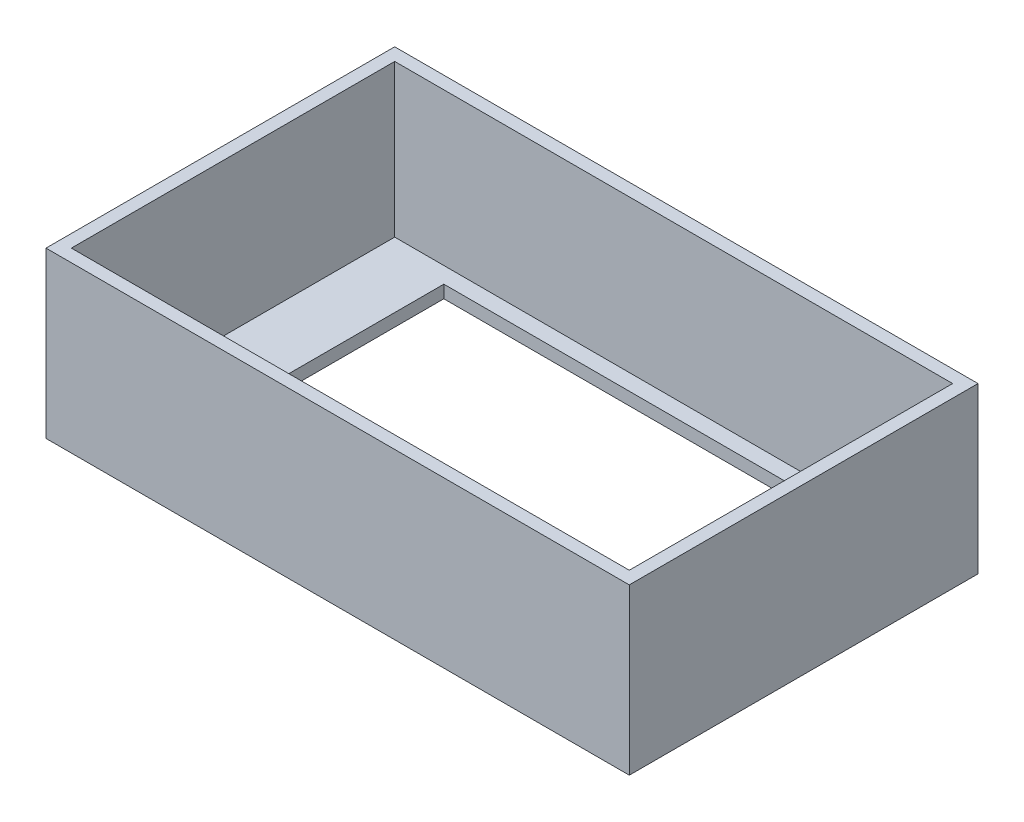
from build123d import *

# Parameters (mm, degrees)
SKETCH1_W           = 88
SKETCH1_H           = 51
BOSS_EXTRUDE1_DEPTH = 2
SKETCH2_W           = 60.2
SKETCH2_H           = 45.9
CUT_EXTRUDE1_DEPTH  = 2
SKETCH3_W           = 92
SKETCH3_H           = 55
SKETCH3_W_2         = 88
SKETCH3_H_2         = 51
BOSS_EXTRUDE2_DEPTH = 26


with BuildPart() as part:
    # Sketch1 → Boss-Extrude1 (new body)
    with BuildSketch(Plane(origin=(0, 0, 0), x_dir=(1, 0, 0), z_dir=(0, 1, 0))):
        Rectangle(SKETCH1_W, SKETCH1_H)
    extrude(amount=BOSS_EXTRUDE1_DEPTH)

    # Sketch2 → Cut-Extrude1 (cut)
    with BuildSketch(Plane(origin=(0, 0, 0), x_dir=(1, 0, 0), z_dir=(0, 1, 0))):
        with Locations((-3.6, 0)):
            Rectangle(SKETCH2_W, SKETCH2_H)
    extrude(amount=CUT_EXTRUDE1_DEPTH, mode=Mode.SUBTRACT)

    # Sketch3 → Boss-Extrude2 (add)
    with BuildSketch(Plane(origin=(0, 0, 0), x_dir=(1, 0, 0), z_dir=(0, 1, 0))):
        Rectangle(SKETCH3_W, SKETCH3_H)
        Rectangle(SKETCH3_W_2, SKETCH3_H_2, mode=Mode.SUBTRACT)
    extrude(amount=BOSS_EXTRUDE2_DEPTH)


solid = part.part
